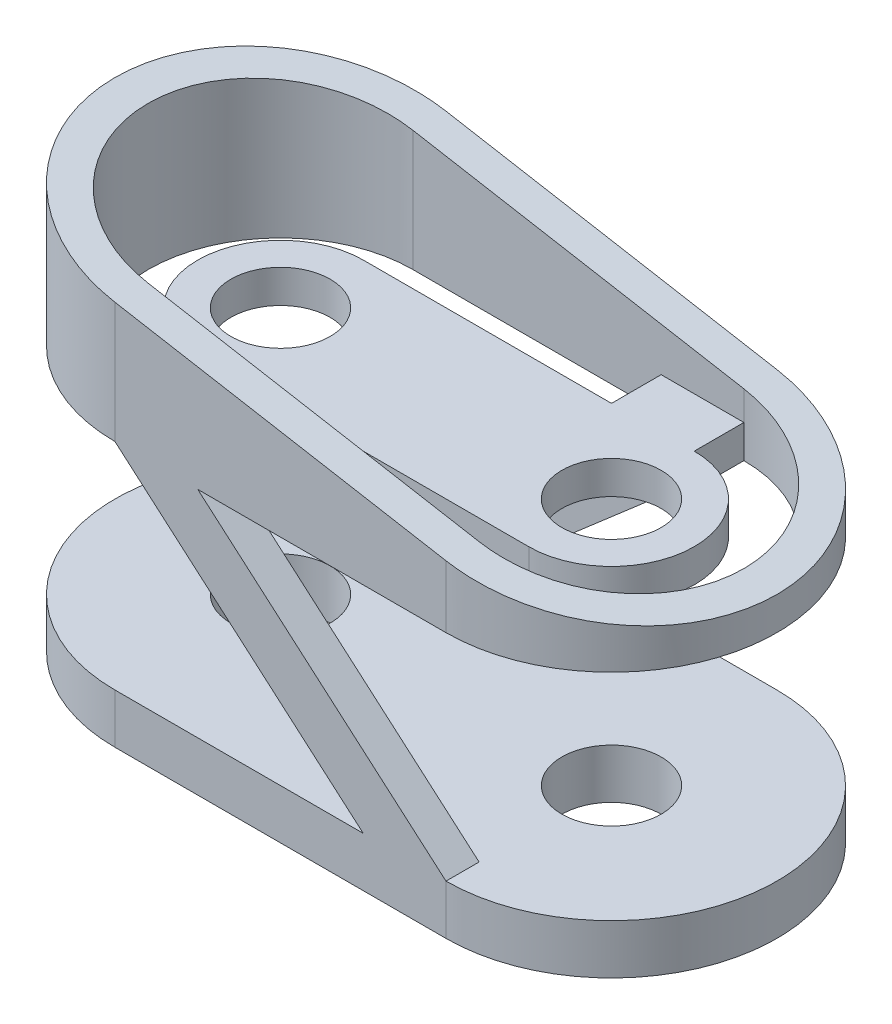
from build123d import *

# Parameters (mm, degrees)
SKETCH1_R               = 15
BOSS_EXTRUDE1_DEPTH     = 15
BOSS_EXTRUDE2_START     = 80
BOSS_EXTRUDE2_DEPTH     = 75
CUT_EXTRUDE1_DEPTH      = 192.115148536
CUT_EXTRUDE1_DEPTH_BACK = 192.115148536
CUT_EXTRUDE2_DEPTH      = 75
SKETCH5_R               = 15
BOSS_EXTRUDE3_DEPTH     = 10
BOSS_EXTRUDE4_DEPTH     = 10
BOSS_EXTRUDE5_DEPTH     = 10


with BuildPart() as part:
    # Sketch1 → Boss-Extrude1 (new body)
    with BuildSketch(Plane(origin=(0, 0, 0), x_dir=(1, 0, 0), z_dir=(0, 1, 0))):
        with BuildLine():
            Line((-50, 50), (50, 50))
            ThreePointArc((50, 50), (100, 0), (50, -50))
            Line((50, -50), (-50, -50))
            ThreePointArc((-50, -50), (-100, 0), (-50, 50))
        make_face()
        with Locations((-50, 0)):
            Circle(SKETCH1_R, mode=Mode.SUBTRACT)
        with Locations((50, 0)):
            Circle(SKETCH1_R, mode=Mode.SUBTRACT)
    extrude(amount=BOSS_EXTRUDE1_DEPTH)



with BuildPart() as body_2:
    # Sketch1<2> → Boss-Extrude2 (new body)
    with BuildSketch(Plane(origin=(0, 0, 0), x_dir=(1, 0, 0), z_dir=(0, 1, 0)).offset(BOSS_EXTRUDE2_START)):
        with BuildLine():
            Line((-50, 50), (50, 50))
            ThreePointArc((50, 50), (100, 0), (50, -50))
            Line((50, -50), (-50, -50))
            ThreePointArc((-50, -50), (-100, 0), (-50, 50))
        make_face()
    extrude(amount=BOSS_EXTRUDE2_DEPTH)

    # Sketch2 → Cut-Extrude1 (cut, two sides: drawn at the far end of the back side and taken through both)
    with BuildSketch(Plane.XY.offset(-CUT_EXTRUDE1_DEPTH_BACK)):
        Polygon((574.658222402, 6.304948775), (100, 90), (-100, 125.265396142), (-574.658222402, 208.960447366), (-407.268119953, 1158.276892171), (742.048324852, 955.62139358), align=None)
    extrude(amount=CUT_EXTRUDE1_DEPTH + CUT_EXTRUDE1_DEPTH_BACK, mode=Mode.SUBTRACT)

    # Sketch3 → Cut-Extrude2 (cut)
    with BuildSketch(Plane.XZ.offset(-80)):
        with BuildLine():
            Line((-50, -40), (50, -40))
            ThreePointArc((50, -40), (90, 0), (50, 40))
            Line((50, 40), (-50, 40))
            ThreePointArc((-50, 40), (-90, 0), (-50, -40))
        make_face()
    extrude(amount=-CUT_EXTRUDE2_DEPTH, mode=Mode.SUBTRACT)

    # Sketch5 → Boss-Extrude3 (add)
    with BuildSketch(Plane.XZ.offset(-80)):
        with BuildLine():
            Line((-25, 25), (50, 25))
            ThreePointArc((50, 25), (75, 0), (50, -25))
            Line((50, -25), (50, -40))
            Line((50, -40), (25, -40))
            Line((25, -40), (25, -25))
            Line((25, -25), (-50, -25))
            ThreePointArc((-50, -25), (-75, 0), (-50, 25))
            Line((-50, 25), (-50, 40))
            Line((-50, 40), (-25, 40))
            Line((-25, 40), (-25, 25))
        make_face()
        with Locations((-50, 0)):
            Circle(SKETCH5_R, mode=Mode.SUBTRACT)
        with Locations((50, 0)):
            Circle(SKETCH5_R, mode=Mode.SUBTRACT)
    extrude(amount=-BOSS_EXTRUDE3_DEPTH)


with BuildPart() as part_1:
    add(part.part)

    add(body_2.part)  # Boss-Extrude4 merges body 2
    # Sketch6 → Boss-Extrude4 (add)
    with BuildSketch(Plane(origin=(0, 0, -50), x_dir=(-1, 0, 0), z_dir=(0, 0, -1))):
        Polygon((50, 15), (-25, 80), (-50, 80), (25, 15), align=None)
    extrude(amount=-BOSS_EXTRUDE4_DEPTH)

    # Sketch7 → Boss-Extrude5 (add)
    with BuildSketch(Plane.XY.offset(50)):
        Polygon((50, 15), (-25, 80), (-50, 80), (25, 15), align=None)
    extrude(amount=-BOSS_EXTRUDE5_DEPTH)


solid = part_1.part
